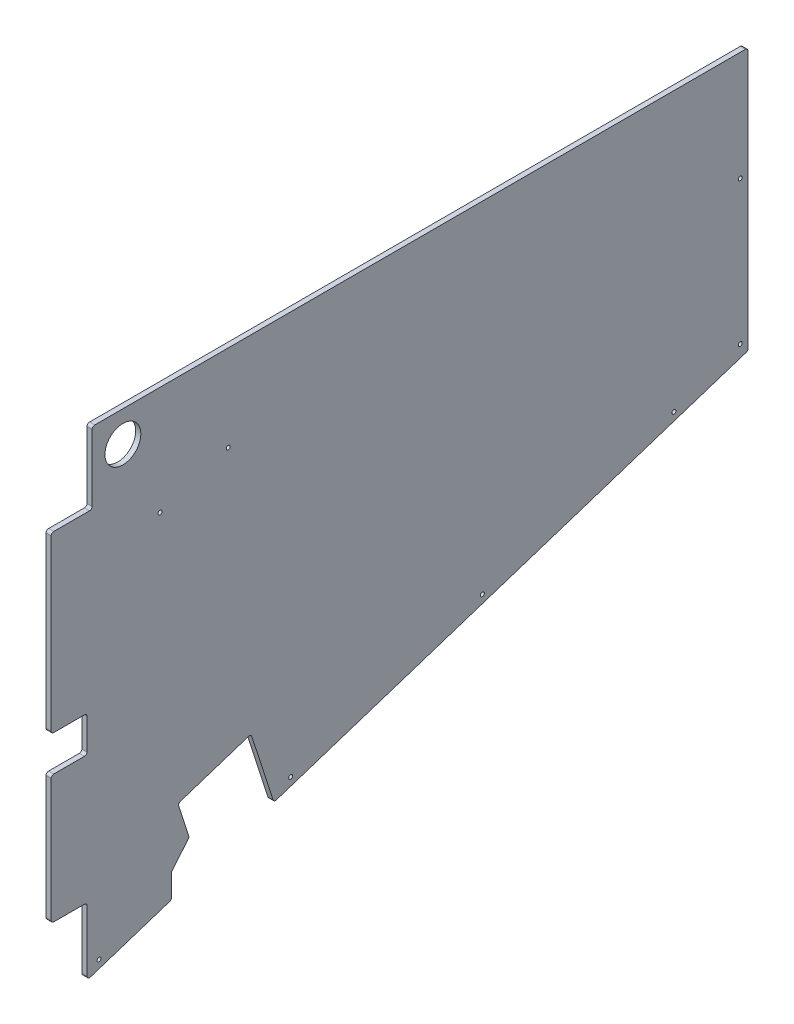
from build123d import *

# Parameters (mm, degrees)
BOSS_EXTRUDE1_DEPTH = 6.35
SKETCH2_R           = 2.45745
SKETCH2_R_2         = 22.225
SKETCH2_W           = 44.45
SKETCH2_H           = 44.45
CUT_EXTRUDE1_DEPTH  = 1236.054594947
FILLET1_R           = 3.175


with BuildPart() as part:
    # Sketch1 → Boss-Extrude1 (new body)
    with BuildSketch(Plane(origin=(0, 0, 0), x_dir=(0, 0, -1), z_dir=(1, 0, 0))):
        Polygon((1016, 533.4), (1066.8, 533.4), (1066.8, 0), (0, 0), (0, 533.4), (50.8, 533.4), (50.8, 622.3), (1016, 622.3), align=None)
    extrude(amount=BOSS_EXTRUDE1_DEPTH)

    # Sketch2 → Cut-Extrude1 (cut, through all)
    with BuildSketch(Plane(origin=(6.35, 0, 0), x_dir=(0, 0, -1), z_dir=(1, 0, 0))):
        with Locations((59.31154, 45.87748)):
            Circle(SKETCH2_R)
        with Locations((296.845703608, 123.057008284)):
            Circle(SKETCH2_R)
        with Locations((534.379867216, 200.236536569)):
            Circle(SKETCH2_R)
        with Locations((771.922083103, 277.418681197)):
            Circle(SKETCH2_R)
        with Locations((854.075, 309.0545)):
            Circle(SKETCH2_R)
        with Locations((854.075, 486.8545)):
            Circle(SKETCH2_R)
        with Locations((219.486424299, 515.220524995)):
            Circle(SKETCH2_R)
        with Locations((134.9375, 487.748914195)):
            Circle(SKETCH2_R)
        with Locations((88.9, 584.2)):
            Circle(SKETCH2_R_2)
        Polygon((149.225, 95.25), (171.033618902, 121.240499926), (157.061866823, 164.241131286), (247.65, 193.675), (276.045265579, 106.283358593), (863.6, 297.191464421), (863.6, 622.3), (1016, 622.3), (1016, 533.4), (1066.8, 533.4), (1066.8, 0), (0, 0), (0, 114.3), (44.45, 114.3), (44.45, 31.033495252), (149.225, 65.076956425), align=None)
        with Locations((22.225, 295.275)):
            Rectangle(SKETCH2_W, SKETCH2_H)
    extrude(amount=-CUT_EXTRUDE1_DEPTH, mode=Mode.SUBTRACT)

    # Fillet1
    fillet1_edges = [part.edges().sort_by_distance(p)[0] for p in [
        (3.175, 533.4, 0),
        (3.175, 533.4, -50.8),
        (3.175, 622.3, -50.8),
        (3.175, 273.05, 0),
        (3.175, 317.5, 0),
        (3.175, 317.5, -44.45),
        (3.175, 273.05, -44.45),
        (3.175, 114.3, 0),
        (3.175, 114.3, -44.45),
        (3.175, 31.033495252, -44.45),
        (3.175, 65.076956425, -149.225),
        (3.175, 95.25, -149.225),
        (3.175, 121.240499926, -171.033618902),
        (3.175, 164.241131286, -157.061866823),
        (3.175, 193.675, -247.65),
        (3.175, 106.283358593, -276.045265579),
        (3.175, 297.191464421, -863.6),
        (3.175, 622.3, -863.6),
    ]]
    fillet(fillet1_edges, radius=FILLET1_R)


solid = part.part
